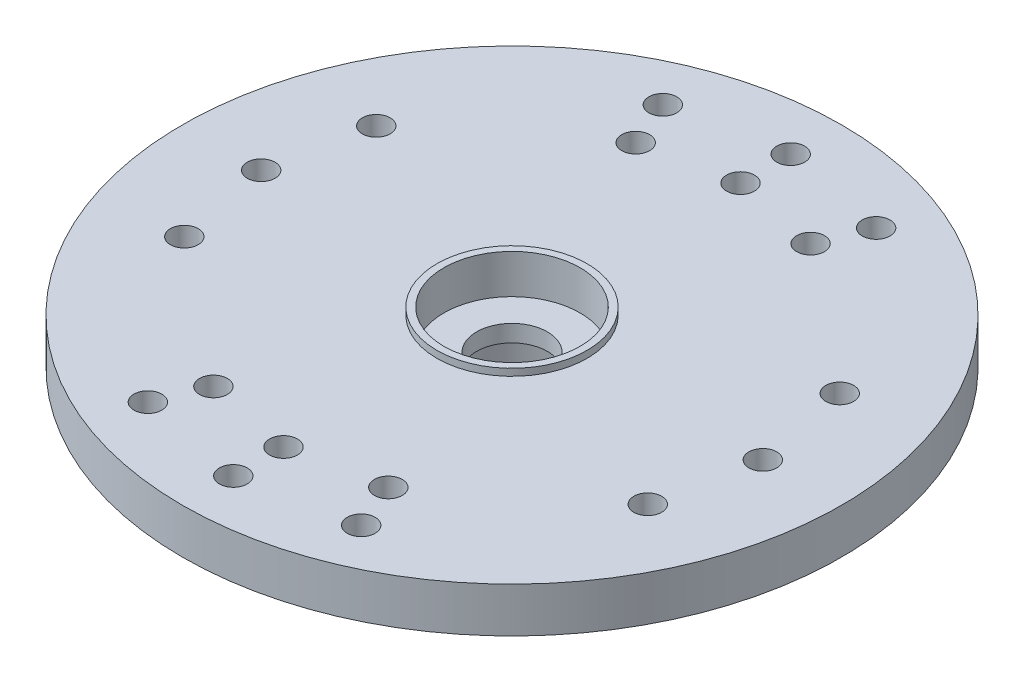
from build123d import *

# Parameters (mm, degrees)
SKETCH18_R                      = 11.825
EXTRUDE17_DEPTH                 = 1.6129
SKETCH19_R                      = 3.4
EXTRUDE19_DEPTH                 = 4.1
SKETCH20_R                      = 0.5
SKETCH20_R_2                    = 1.27
EXTRUDE20_DEPTH                 = 18.218340512
SKETCH23_R                      = 0.5
CUT_EXTRUDE1_DEPTH              = 18.218340512
CIRPATTERN1_COUNT               = 2
CIRPATTERN1_ANGLE               = 22.5
CIRPATTERN1_THE_OTHER_WAY_COUNT = 2
CIRPATTERN1_THE_OTHER_WAY_ANGLE = 22.5
MIRROR2_COPY_1_SKETCH_R         = 0.5
MIRROR2_COPY_1_DEPTH            = 18.218340512
MIRROR2_COPY_2_SKETCH_R         = 0.5
MIRROR2_COPY_2_DEPTH            = 18.218340512
SKETCH21_R                      = 2.44475
EXTRUDE21_DEPTH                 = 1.1557
SKETCH22_R                      = 2.286
EXTRUDE22_DEPTH                 = 2.3368
EXTRUDE22_DRAFT                 = -5
BOSS_EXTRUDE1_START             = 0.25
SKETCH24_R                      = 2.69475
SKETCH24_R_2                    = 2.44475
BOSS_EXTRUDE1_DEPTH             = 0.25
FILLET1_R                       = 0.5


with BuildPart() as part:
    # Sketch18 → Extrude17 (new body)
    with BuildSketch(Plane(origin=(0, 0, 0), x_dir=(1, 0, 0), z_dir=(0, 1, 0))):
        with Locations(Location((0, 0, 0), (0, 0, 270))):
            Circle(SKETCH18_R)
    extrude(amount=EXTRUDE17_DEPTH)

    # Sketch19 → Extrude19 (add)
    with BuildSketch(Plane(origin=(0, 1.6129, 0), x_dir=(1, 0, 0), z_dir=(0, 1, 0))):
        with Locations(Location((0, 0, 0), (0, 0, 270))):
            Circle(SKETCH19_R)
    extrude(amount=-EXTRUDE19_DEPTH)

    # Sketch20 → Extrude20 (cut, through all)
    with BuildSketch(Plane(origin=(0, 1.6129, 0), x_dir=(1, 0, 0), z_dir=(0, 1, 0))):
        with Locations(Location((-9, 0, 0), (0, 0, 270))):
            Circle(SKETCH20_R)
        with Locations(Location((0, 0, 0), (0, 0, 270))):
            Circle(SKETCH20_R_2)
        with Locations(Location((-8.314915793, 3.444150891, 0), (0, 0, 270))):
            Circle(SKETCH20_R)
        with Locations(Location((-8.314915793, -3.444150891, 0), (0, 0, 270))):
            Circle(SKETCH20_R)
    extrude20 = extrude(amount=-EXTRUDE20_DEPTH, mode=Mode.SUBTRACT)

    # Mirror1: Extrude20 across plane
    add(extrude20.mirror(Plane(origin=(0, 0, 0), x_dir=(0, 0, 1), z_dir=(1, 0, 0))), mode=Mode.SUBTRACT)

    # Sketch23 → Cut-Extrude1 (cut, through all)
    with BuildSketch(Plane(origin=(0, 1.6129, 0), x_dir=(1, 0, 0), z_dir=(0, 1, 0))):
        with Locations(Location((0, 8.2, 0), (0, 0, 270))):
            Circle(SKETCH23_R)
        with Locations(Location((0, 10, 0), (0, 0, 270))):
            Circle(SKETCH23_R)
    cut_extrude1 = extrude(amount=-CUT_EXTRUDE1_DEPTH, mode=Mode.SUBTRACT)

    # CirPattern1: Cut-Extrude1 ×2 about axis
    cirpattern1_axis = Axis((0, 0, 0), (0, 1, 0))
    for i in range(1, CIRPATTERN1_COUNT):
        add(cut_extrude1.rotate(cirpattern1_axis, i * CIRPATTERN1_ANGLE / (CIRPATTERN1_COUNT - 1)), mode=Mode.SUBTRACT)

    # CirPattern1 the other way: Cut-Extrude1 ×2 about axis
    cirpattern1_the_other_way_axis = Axis((0, 0, 0), (0, -1, 0))
    for i in range(1, CIRPATTERN1_THE_OTHER_WAY_COUNT):
        add(cut_extrude1.rotate(cirpattern1_the_other_way_axis, i * CIRPATTERN1_THE_OTHER_WAY_ANGLE / (CIRPATTERN1_THE_OTHER_WAY_COUNT - 1)), mode=Mode.SUBTRACT)

    # Mirror2: Cut-Extrude1 across plane
    add(cut_extrude1.mirror(Plane.XY), mode=Mode.SUBTRACT)

    # Mirror2 copy 1 sketch → Mirror2 copy 1 (cut, through all)
    with BuildSketch(Plane(origin=(0, 1.6129, 0), x_dir=(0.9238795325112864, 0, 0.38268343236509056), z_dir=(0, 1, 0))):
        with Locations((0, -8.2)):
            Circle(MIRROR2_COPY_1_SKETCH_R)
        with Locations((0, -10)):
            Circle(MIRROR2_COPY_1_SKETCH_R)
    extrude(amount=-MIRROR2_COPY_1_DEPTH, mode=Mode.SUBTRACT)

    # Mirror2 copy 2 sketch → Mirror2 copy 2 (cut, through all)
    with BuildSketch(Plane(origin=(0, 1.6129, 0), x_dir=(0.9238795325112864, 0, -0.38268343236509056), z_dir=(0, 1, 0))):
        with Locations((0, -8.2)):
            Circle(MIRROR2_COPY_2_SKETCH_R)
        with Locations((0, -10)):
            Circle(MIRROR2_COPY_2_SKETCH_R)
    extrude(amount=-MIRROR2_COPY_2_DEPTH, mode=Mode.SUBTRACT)

    # Sketch21 → Extrude21 (cut)
    with BuildSketch(Plane(origin=(0, 1.6129, 0), x_dir=(1, 0, 0), z_dir=(0, 1, 0))):
        with Locations(Location((0, 0, 0), (0, 0, 270))):
            Circle(SKETCH21_R)
    extrude(amount=-EXTRUDE21_DEPTH, mode=Mode.SUBTRACT)


with BuildPart() as extrude22_tool:
    # Sketch22 → Extrude22 (with draft: the straight prism first)
    with BuildSketch(Plane.XZ.offset(2.4871)):
        Circle(SKETCH22_R)
    extrude(amount=-EXTRUDE22_DEPTH)
    # Extrude22: the draft: its side faces are tilted about the plane it starts from
    extrude22_sides = [extrude22_tool.faces().sort_by_distance(p)[0] for p in [
        (-2.286, -1.3187, 0),
    ]]
    draft(extrude22_sides, Plane.XZ.offset(2.4871), EXTRUDE22_DRAFT)


with BuildPart() as part_1:
    add(part.part)

    # Extrude22: cut by extrude22_tool
    add(extrude22_tool.part, mode=Mode.SUBTRACT)

    # Sketch24 → Boss-Extrude1 (add)
    with BuildSketch(Plane(origin=(0, 1.6129, 0), x_dir=(1, 0, 0), z_dir=(0, 1, 0)).offset(BOSS_EXTRUDE1_START)):
        with Locations(Location((0, 0, 0), (0, 0, 270))):
            Circle(SKETCH24_R)
        with Locations(Location((0, 0, 0), (0, 0, 270))):
            Circle(SKETCH24_R_2, mode=Mode.SUBTRACT)
    extrude(amount=-BOSS_EXTRUDE1_DEPTH)

    # Fillet1
    fillet1_edges = [part_1.edges().sort_by_distance(p)[0] for p in [
        (0, 0, -3.4),
    ]]
    fillet(fillet1_edges, radius=FILLET1_R)


solid = part_1.part
